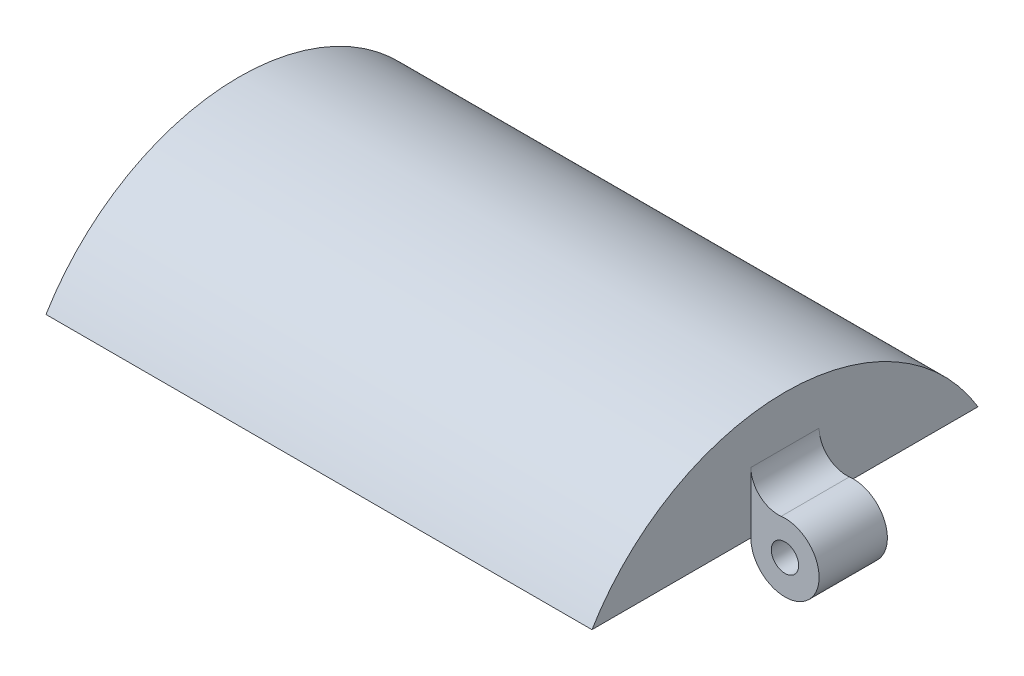
from build123d import *

# Parameters (mm, degrees)
SKETCH2_R               = 16.5
BOSS_EXTRUDE1_DEPTH     = 40
SKETCH3_W               = 33
SKETCH3_H               = 25
CUT_EXTRUDE1_DEPTH      = 40
CUT_EXTRUDE2_REACH      = 45.174
CUT_EXTRUDE2_END_RADIUS = 15.5
SKETCH4_W               = 36
SKETCH4_H               = 24.284271248
SKETCH5_W               = 37
SKETCH5_H               = 25.284271248
SKETCH5_W_2             = 36
SKETCH5_H_2             = 24.284271248
BOSS_EXTRUDE2_DEPTH     = 1.5
SKETCH7_R               = 1
BOSS_EXTRUDE3_DEPTH     = 2.5


with BuildPart() as part:
    # Sketch2 → Boss-Extrude1 (new body)
    with BuildSketch(Plane(origin=(0, 0, 0), x_dir=(0, 0, -1), z_dir=(1, 0, 0))):
        Circle(SKETCH2_R)
    extrude(amount=BOSS_EXTRUDE1_DEPTH)

    # Sketch3 → Cut-Extrude1 (cut)
    with BuildSketch(Plane.ZY):
        with Locations((0, -4)):
            Rectangle(SKETCH3_W, SKETCH3_H)
    extrude(amount=-CUT_EXTRUDE1_DEPTH, mode=Mode.SUBTRACT)

    # Cut-Extrude2: up to this cylinder (the profile starts inside it)
    cut_extrude2_end = Plane(origin=(20, 0, 0), z_dir=(-1, 0, 0)) * Cylinder(CUT_EXTRUDE2_END_RADIUS, 122.348, mode=Mode.PRIVATE)
    # Sketch4 → Cut-Extrude2 (cut, up to the surface)
    with BuildSketch(Plane.XZ.offset(-8.5), mode=Mode.PRIVATE) as cut_extrude2_sk1:
        with Locations((20, 0)):
            Rectangle(SKETCH4_W, SKETCH4_H)
    cut_extrude2_tool1 = extrude(cut_extrude2_sk1.sketch, amount=-CUT_EXTRUDE2_REACH, mode=Mode.PRIVATE) & cut_extrude2_end
    add(cut_extrude2_tool1.solids().sort_by_distance((20, 8.5, 0))[0], mode=Mode.SUBTRACT)

    # Sketch5 → Boss-Extrude2 (add)
    with BuildSketch(Plane.XZ.offset(-8.5)):
        with Locations((20, 0)):
            Rectangle(SKETCH5_W, SKETCH5_H)
        with Locations((20, 0)):
            Rectangle(SKETCH5_W_2, SKETCH5_H_2, mode=Mode.SUBTRACT)
    extrude(amount=BOSS_EXTRUDE2_DEPTH)

    # Sketch7 → Boss-Extrude3 (add, symmetric)
    with BuildSketch(Plane.XY):
        with BuildLine():
            Line((40, 8.5), (40, 12.972135955))
            ThreePointArc((40, 12.972135955), (40.666666667, 11.48142397), (42.222222222, 10.984519975))
            ThreePointArc((42.222222222, 10.984519975), (44.363389981, 6.833333333), (40, 8.5))
        make_face()
        with Locations((42.5, 8.5)):
            Circle(SKETCH7_R, mode=Mode.SUBTRACT)
    boss_extrude3 = extrude(amount=BOSS_EXTRUDE3_DEPTH, both=True)

    # Mirror2: Boss-Extrude3 across plane
    add(boss_extrude3.mirror(Plane(origin=(20, 0, 0), x_dir=(0, 0, 1), z_dir=(1, 0, 0))))


solid = part.part
